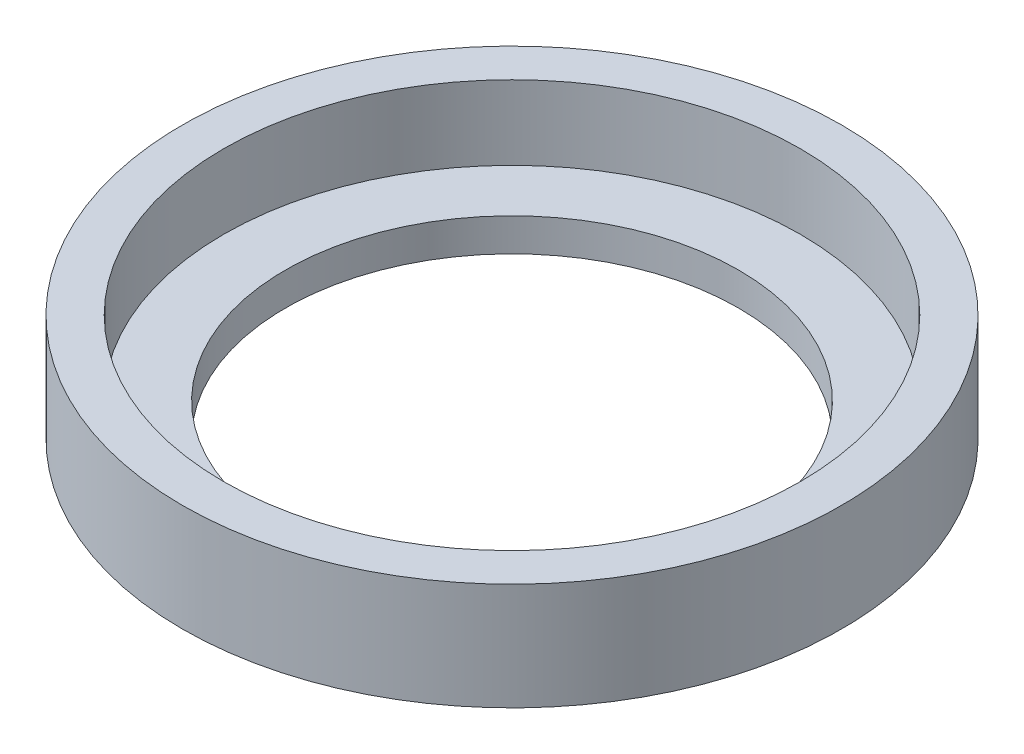
from build123d import *

# Parameters (mm, degrees)
SKETCH_1_R      = 40
SKETCH_1_R_2    = 35
EXTRUDE_1_DEPTH = 9
EXTRUDE_START   = 4
SKETCH_2_R      = 40
SKETCH_2_R_2    = 27.5
EXTRUDE_2_DEPTH = 4


with BuildPart() as part:
    # 草图1 → 凸台-拉伸1 (new body)
    with BuildSketch(Plane(origin=(0, 0, 0), x_dir=(1, 0, 0), z_dir=(0, 1, 0))):
        with Locations(Location((0, 0, 0), (0, 0, 270))):
            Circle(SKETCH_1_R)
        with Locations(Location((0, 0, 0), (0, 0, 270))):
            Circle(SKETCH_1_R_2, mode=Mode.SUBTRACT)
    extrude(amount=EXTRUDE_1_DEPTH)

    # 草图2 → 凸台-拉伸2 (add)
    with BuildSketch(Plane.XZ.offset(EXTRUDE_START)):
        with Locations(Location((0, 0, 0), (0, 0, 270))):
            Circle(SKETCH_2_R)
        with Locations(Location((0, 0, 0), (0, 0, 270))):
            Circle(SKETCH_2_R_2, mode=Mode.SUBTRACT)
    extrude(amount=-EXTRUDE_2_DEPTH)


solid = part.part
